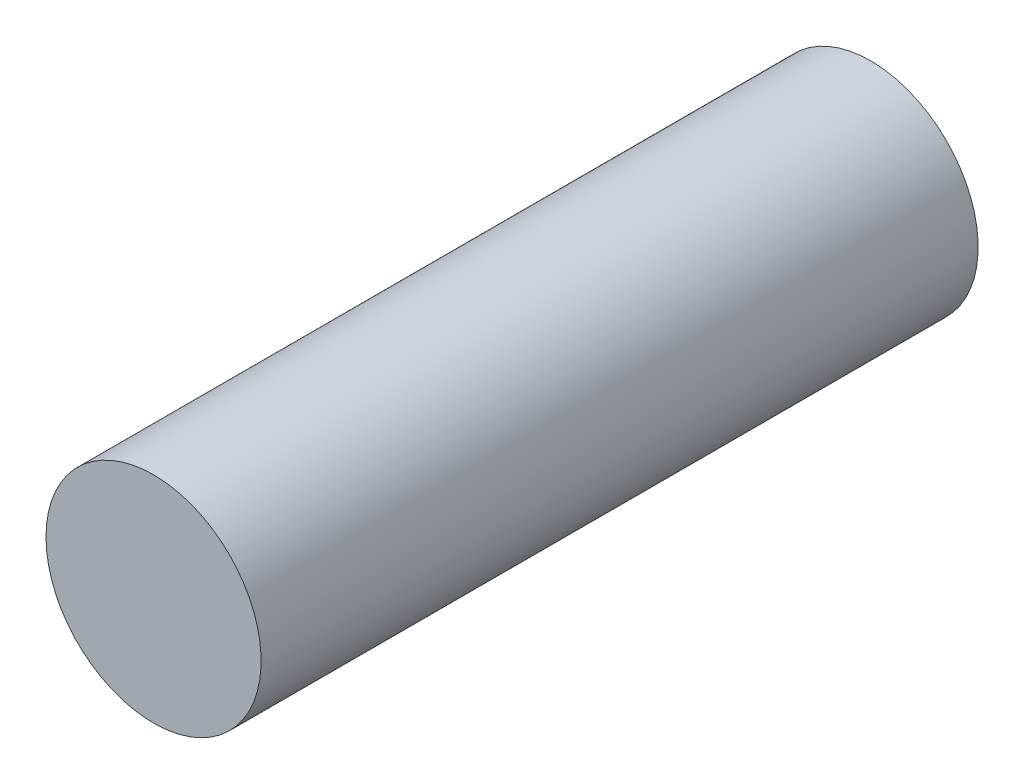
from build123d import *

# Parameters (mm, degrees)
SKETCH1_R           = 2.286
BOSS_EXTRUDE1_DEPTH = 15.24


with BuildPart() as part:
    # Sketch1 → Boss-Extrude1 (new body)
    with BuildSketch(Plane.XY):
        with Locations(Location((0, 0, 0), (0, 0, 180))):
            Circle(SKETCH1_R)
    extrude(amount=BOSS_EXTRUDE1_DEPTH)


solid = part.part
